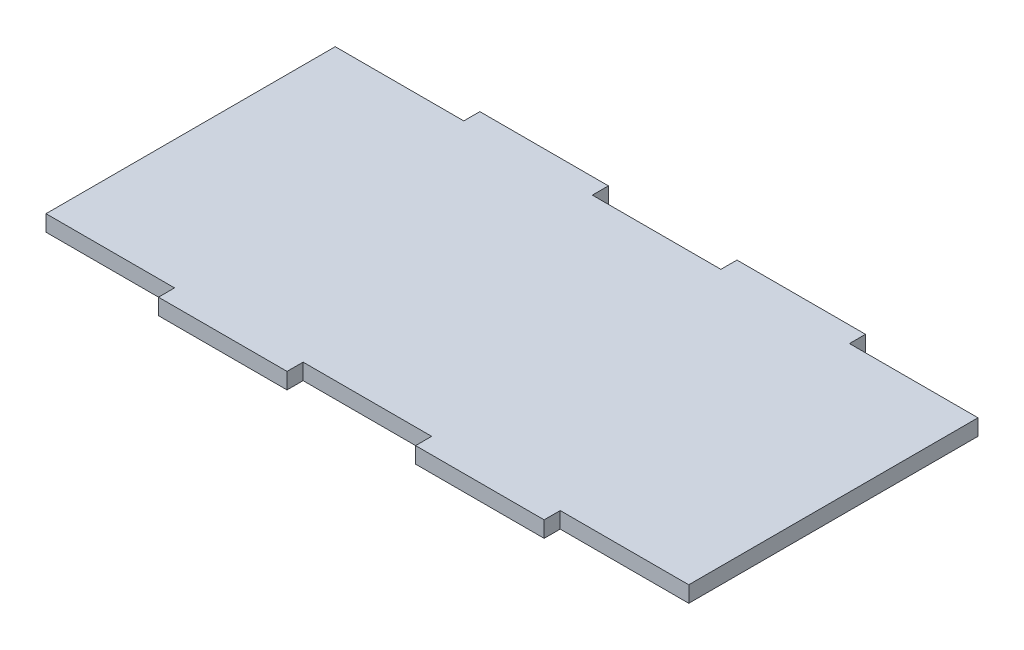
from build123d import *

# Parameters (mm, degrees)
BOSS_EXTRUDE1_DEPTH = 3.175


with BuildPart() as part:
    # Sketch1 → Boss-Extrude1 (new body)
    with BuildSketch(Plane(origin=(0, 0, 0), x_dir=(1, 0, 0), z_dir=(0, 1, 0))):
        Polygon((0, 0), (25.4, 0), (25.4, -3.175), (50.8, -3.175), (50.8, 0), (76.2, 0), (76.2, -3.175), (101.6, -3.175), (101.6, 0), (127, 0), (127, 15.875), (127, 41.275), (127, 57.15), (101.6, 57.15), (101.6, 60.325), (76.2, 60.325), (76.2, 57.15), (50.8, 57.15), (50.8, 60.325), (25.4, 60.325), (25.4, 57.15), (0, 57.15), (0, 41.275), (0, 15.875), align=None)
    extrude(amount=BOSS_EXTRUDE1_DEPTH)


solid = part.part
